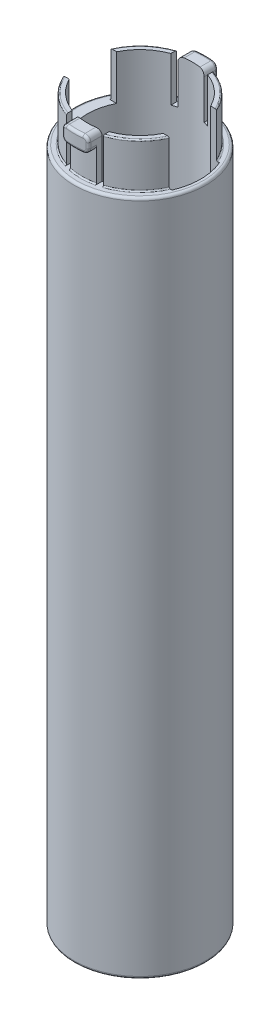
from build123d import *

# Parameters (mm, degrees)
SKETCH_6_R           = 12.5
EXTRUDE_2_DEPTH      = 68.5
SKETCH_7_R           = 10
CUT_EXTRUDE_3_DEPTH  = 80
CUT_EXTRUDE_5_DEPTH  = 80
SKETCH_9_R           = 12.5
SKETCH_9_R_2         = 11
CUT_EXTRUDE_6_DEPTH  = 8.5
CUT_EXTRUDE_7_DEPTH  = 8.5
EXTRUDE_3_REACH      = 75.176
EXTRUDE_3_END_RADIUS = 12.5
SKETCH_11_W          = 5
SKETCH_11_H          = 3
SKETCH_13_W          = 1
SKETCH_13_H          = 21.424285286
CUT_EXTRUDE_8_DEPTH  = 8.5
FILLET_1_R           = 1
SKETCH_14_R          = 9.5
CUT_EXTRUDE_9_DEPTH  = 3
FILLET_2_R           = 0.5
SKETCH_15_R          = 8
CUT_EXTRUDE_10_DEPTH = 136.161015198
CUT_EXTRUDE_11_DEPTH = 5
FILLET_3_R           = 0.5
FILLET_4_R           = 0.25
FILLET_6_R           = 0.25


with BuildPart() as part:
    # 草图6 → 凸台-拉伸2 (new, symmetric)
    with BuildSketch(Plane(origin=(0, 0, 0), x_dir=(1, 0, 0), z_dir=(0, 1, 0))):
        with Locations(Location((0, 0, 0), (0, 0, 270))):
            Circle(SKETCH_6_R)
    extrude(amount=EXTRUDE_2_DEPTH, both=True)

    # 草图7 → 切除-拉伸3 (cut)
    with BuildSketch(Plane(origin=(0, 68.5, 0), x_dir=(1, 0, 0), z_dir=(0, 1, 0))):
        with Locations(Location((0, 0, 0), (0, 0, 270))):
            Circle(SKETCH_7_R)
    extrude(amount=-CUT_EXTRUDE_3_DEPTH, mode=Mode.SUBTRACT)

    # 草图8 → 切除-拉伸5 (cut)
    with BuildSketch(Plane(origin=(0, 68.5, 0), x_dir=(1, 0, 0), z_dir=(0, 1, 0))):
        with BuildLine():
            Line((8.93028555, 4.5), (10.583005244, 4.5))
            ThreePointArc((10.583005244, 4.5), (11.5, 0), (10.583005244, -4.5))
            Line((10.583005244, -4.5), (8.93028555, -4.5))
            ThreePointArc((8.93028555, -4.5), (10, 0), (8.93028555, 4.5))
        make_face()
    extrude(amount=-CUT_EXTRUDE_5_DEPTH, mode=Mode.SUBTRACT)

    # 草图9 → 切除-拉伸6 (cut)
    with BuildSketch(Plane(origin=(0, 68.5, 0), x_dir=(1, 0, 0), z_dir=(0, 1, 0))):
        with Locations(Location((0, 0, 0), (0, 0, 270))):
            Circle(SKETCH_9_R)
        Circle(SKETCH_9_R_2, mode=Mode.SUBTRACT)
    extrude(amount=-CUT_EXTRUDE_6_DEPTH, mode=Mode.SUBTRACT)

    # 草图10 → 切除-拉伸7 (cut)
    with BuildSketch(Plane(origin=(0, 68.5, 0), x_dir=(1, 0, 0), z_dir=(0, 1, 0))):
        with BuildLine():
            Line((-10.03742995, -4.5), (-8.93028555, -4.5))
            ThreePointArc((-8.93028555, -4.5), (-10, 0), (-8.93028555, 4.5))
            Line((-8.93028555, 4.5), (-10.03742995, 4.5))
            ThreePointArc((-10.03742995, 4.5), (-11, 0), (-10.03742995, -4.5))
        make_face()
    extrude(amount=-CUT_EXTRUDE_7_DEPTH, mode=Mode.SUBTRACT)

    # 凸台-拉伸3: up to this cylinder (the profile starts inside it)
    extrude_3_end = Plane(origin=(0, 67, 0), z_dir=(0, -1, 0)) * Cylinder(EXTRUDE_3_END_RADIUS, 176.352, mode=Mode.PRIVATE)
    # 草图11 → 凸台-拉伸3 (add, up to the surface)
    with BuildSketch(Plane.XY.offset(10), mode=Mode.PRIVATE) as extrude_3_sk1:
        with Locations((0, 67)):
            Rectangle(SKETCH_11_W, SKETCH_11_H)
    extrude_3_tool1 = extrude(extrude_3_sk1.sketch, amount=EXTRUDE_3_REACH, mode=Mode.PRIVATE) & extrude_3_end
    extrude_3 = extrude_3_tool1.solids().sort_by_distance((0, 67, 10))[0]
    add(extrude_3)

    # 镜向1: 凸台-拉伸3 across plane
    add(extrude_3.mirror(Plane.XY))

    # 草图13 → 切除-拉伸8 (cut)
    with BuildSketch(Plane(origin=(0, 68.5, 0), x_dir=(1, 0, 0), z_dir=(0, 1, 0))):
        with Locations((3, 0)):
            Rectangle(SKETCH_13_W, SKETCH_13_H)
        with Locations((-3, 0)):
            Rectangle(SKETCH_13_W, SKETCH_13_H)
    extrude(amount=-CUT_EXTRUDE_8_DEPTH, mode=Mode.SUBTRACT)

    # 圆角1
    fillet_1_edges = [part.edges().sort_by_distance(p)[0] for p in [
        (-2.5, 65.5, 11.479795678),
        (-2.5, 68.5, 10.96495354),
        (2.5, 68.5, 10.96495354),
        (2.5, 65.5, 11.479795678),
        (2.5, 68.5, -10.96495354),
        (2.5, 65.5, -11.479795678),
        (-2.5, 65.5, -11.479795678),
        (-2.5, 68.5, -10.96495354),
    ]]
    fillet(fillet_1_edges, radius=FILLET_1_R)

    # 草图14 → 切除-拉伸9 (cut)
    with BuildSketch(Plane(origin=(0, -68.5, 0), x_dir=(-1, 0, 0), z_dir=(0, -1, 0))):
        with Locations(Location((0, 0, 0), (0, 0, 90))):
            Circle(SKETCH_14_R)
    extrude(amount=-CUT_EXTRUDE_9_DEPTH, mode=Mode.SUBTRACT)

    # 圆角2
    fillet_2_edges = [part.edges().sort_by_distance(p)[0] for p in [
        (0, 65.5, -12.5),
        (2.5, 67, -12.247448714),
        (-2.5, 67, -12.247448714),
        (0, 68.5, -12.5),
        (-2.205496398, 68.208713527, -12.303893111),
        (2.205496388, 68.208713515, -12.303893111),
        (-2.205496398, 65.791286473, -12.303893111),
        (2.205496388, 65.791286485, -12.303893111),
        (0, 65.5, 12.5),
        (-2.5, 67, 12.247448714),
        (0, 68.5, 12.5),
        (2.5, 67, 12.247448714),
        (2.205496388, 68.208713515, 12.303893111),
        (2.205496388, 65.791286485, 12.303893111),
        (-2.205496398, 68.208713527, 12.303893111),
        (-2.205496398, 65.791286473, 12.303893111),
    ]]
    fillet(fillet_2_edges, radius=FILLET_2_R)

    # 草图15 → 切除-拉伸10 (cut, through all)
    with BuildSketch(Plane(origin=(0, -65.5, 0), x_dir=(-1, 0, 0), z_dir=(0, -1, 0))):
        with Locations(Location((0, 0, 0), (0, 0, 90))):
            Circle(SKETCH_15_R)
    extrude(amount=-CUT_EXTRUDE_10_DEPTH, mode=Mode.SUBTRACT)

    # 草图16 → 切除-拉伸11 (cut)
    with BuildSketch(Plane(origin=(0, -11.5, 0), x_dir=(1, 0, 0), z_dir=(0, 1, 0))):
        with BuildLine():
            Line((10.583005244, 4.5), (6.614378278, 4.5))
            ThreePointArc((6.614378278, 4.5), (8, 0), (6.614378278, -4.5))
            Line((6.614378278, -4.5), (10.583005244, -4.5))
            ThreePointArc((10.583005244, -4.5), (11.5, 0), (10.583005244, 4.5))
        make_face()
    extrude(amount=-CUT_EXTRUDE_11_DEPTH, mode=Mode.SUBTRACT)

    # 圆角3
    fillet_3_edges = [part.edges().sort_by_distance(p)[0] for p in [
        (0, -68.5, -12.5),
        (0, -65.5, 9.5),
        (0, -68.5, 9.5),
        (0, 60, -12.5),
        (0, -65.5, 8),
    ]]
    fillet(fillet_3_edges, radius=FILLET_3_R)

    # 圆角4
    fillet_4_edges = [part.edges().sort_by_distance(p)[0] for p in [
        (-7.389300853, 68.5, -8.148511085),
        (7.389300853, 68.5, -8.148511085),
        (-7.389300853, 68.5, 8.148511085),
        (7.389300853, 68.5, 8.148511085),
    ]]
    fillet(fillet_4_edges, radius=FILLET_4_R)

    # 圆角6
    fillet_6_edges = [part.edges().sort_by_distance(p)[0] for p in [
        (0, 60, 11),
        (7.389300853, 60, 8.148511085),
        (0, 60, -11),
        (-7.389300853, 60, -8.148511085),
        (7.389300853, 60, -8.148511085),
        (-7.389300853, 60, 8.148511085),
    ]]
    fillet(fillet_6_edges, radius=FILLET_6_R)


solid = part.part
